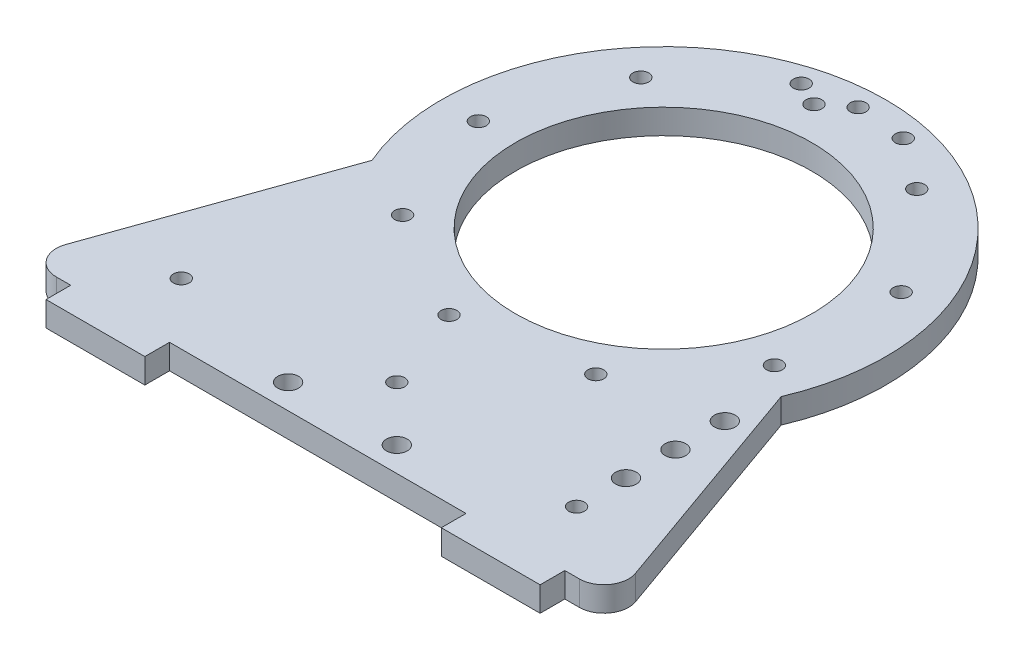
from build123d import *

# Parameters (mm, degrees)
SKETCH_1_R          = 1.6
SKETCH_1_R_2        = 30
SKETCH_1_R_3        = 2.1
EXTRUDE_1_DEPTH     = 2.5
SKETCH_2_W          = 20
SKETCH_2_H          = 5
EXTRUDE_2_DEPTH     = 5
CUT_EXTRUDE_1_DEPTH = 97.176920308
FILLET_1_R          = 5


with BuildPart() as part:
    # 草图1 → 凸台-拉伸1 (new, symmetric)
    with BuildSketch(Plane(origin=(0, 0, 0), x_dir=(1, 0, 0), z_dir=(0, 1, 0))):
        with BuildLine():
            Line((-60, 0), (-60, -70))
            Line((-60, -70), (60, -70))
            Line((60, -70), (60, 0))
            ThreePointArc((60, 0), (42.426406871, 42.426406871), (0, 60))
            ThreePointArc((0, 60), (-42.426406871, 42.426406871), (-60, 0))
        make_face()
        with Locations(Location((-37.5, 0, 0), (0, 0, 270))):
            Circle(SKETCH_1_R, mode=Mode.SUBTRACT)
        with Locations(Location((-40, -57.62, 0), (0, 0, 270))):
            Circle(SKETCH_1_R, mode=Mode.SUBTRACT)
        with Locations(Location((40, -57.62, 0), (0, 0, 270))):
            Circle(SKETCH_1_R, mode=Mode.SUBTRACT)
        with Locations(Location((0, 0, 0), (0, 0, 270))):
            Circle(SKETCH_1_R_2, mode=Mode.SUBTRACT)
        with Locations(Location((-28.726666617, 24.104535363, 0), (0, 0, 270))):
            Circle(SKETCH_1_R, mode=Mode.SUBTRACT)
        with Locations(Location((-6.511806663, 36.930290738, 0), (0, 0, 270))):
            Circle(SKETCH_1_R, mode=Mode.SUBTRACT)
        with Locations(Location((18.75, 32.475952642, 0), (0, 0, 270))):
            Circle(SKETCH_1_R, mode=Mode.SUBTRACT)
        with Locations(Location((35.238473279, 12.825755375, 0), (0, 0, 270))):
            Circle(SKETCH_1_R, mode=Mode.SUBTRACT)
        with Locations(Location((35.238473279, -12.825755375, 0), (0, 0, 270))):
            Circle(SKETCH_1_R, mode=Mode.SUBTRACT)
        with Locations(Location((18.75, -32.475952642, 0), (0, 0, 270))):
            Circle(SKETCH_1_R, mode=Mode.SUBTRACT)
        with Locations(Location((-6.511806663, -36.930290738, 0), (0, 0, 270))):
            Circle(SKETCH_1_R, mode=Mode.SUBTRACT)
        with Locations(Location((-28.726666617, -24.104535363, 0), (0, 0, 270))):
            Circle(SKETCH_1_R, mode=Mode.SUBTRACT)
        with Locations(Location((-11, -65, 0), (0, 0, 270))):
            Circle(SKETCH_1_R_3, mode=Mode.SUBTRACT)
        with Locations(Location((11, -65, 0), (0, 0, 90))):
            Circle(SKETCH_1_R_3, mode=Mode.SUBTRACT)
        with Locations(Location((40, -47.62, 0), (0, 0, 270))):
            Circle(SKETCH_1_R_3, mode=Mode.SUBTRACT)
        with Locations(Location((40, -37.62, 0), (0, 0, 270))):
            Circle(SKETCH_1_R_3, mode=Mode.SUBTRACT)
        with Locations(Location((40, -27.62, 0), (0, 0, 270))):
            Circle(SKETCH_1_R_3, mode=Mode.SUBTRACT)
        with Locations(Location((0, -54, 0), (0, 0, 270))):
            Circle(SKETCH_1_R, mode=Mode.SUBTRACT)
        with Locations(Location((8.488193337, 40, 0), (0, 0, 270))):
            Circle(SKETCH_1_R, mode=Mode.SUBTRACT)
        with Locations(Location((-1.511806663, 40.862744239, 0), (0, 0, 270))):
            Circle(SKETCH_1_R, mode=Mode.SUBTRACT)
        with Locations(Location((-11.420717282, 39.263426275, 0), (0, 0, 270))):
            Circle(SKETCH_1_R, mode=Mode.SUBTRACT)
    extrude(amount=EXTRUDE_1_DEPTH, both=True)

    # 草图2 → 凸台-拉伸2 (add)
    with BuildSketch(Plane.XY.offset(70)):
        with Locations((40, 0)):
            Rectangle(SKETCH_2_W, SKETCH_2_H)
        with Locations((-40, 0)):
            Rectangle(SKETCH_2_W, SKETCH_2_H)
    extrude(amount=EXTRUDE_2_DEPTH)

    # 草图3 → 切除-拉伸1 (cut, through all)
    with BuildSketch(Plane(origin=(0, 2.5, 0), x_dir=(1, 0, 0), z_dir=(0, 1, 0))):
        with BuildLine():
            ThreePointArc((41.406951107, -17.62), (0, 45), (-41.406951107, -17.62))
            Line((-41.406951107, -17.62), (-60, -70))
            Line((-60, -70), (-60, 0))
            ThreePointArc((-60, 0), (0, 60), (60, 0))
            Line((60, 0), (60, -70))
            Line((60, -70), (41.406951107, -17.62))
        make_face()
    extrude(amount=-CUT_EXTRUDE_1_DEPTH, mode=Mode.SUBTRACT)

    # 圆角1
    fillet_1_edges = [part.edges().sort_by_distance(p)[0] for p in [
        (60, 0, 70),
        (-60, 0, 70),
    ]]
    fillet(fillet_1_edges, radius=FILLET_1_R)


solid = part.part
